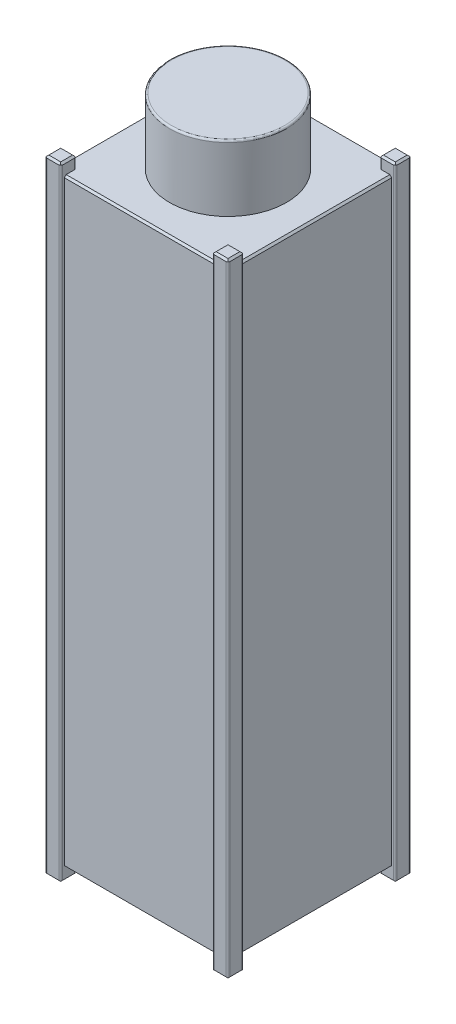
from build123d import *

# Parameters (mm, degrees)
SKETCH1_W                = 100
SKETCH1_H                = 100
BOSS_EXTRUDE1_DEPTH      = 327.8
SKETCH2_W                = 8.5
SKETCH2_H                = 8.5
BOSS_EXTRUDE2_DEPTH      = 6.5
CHAMFER1_SIZE            = 1
SKETCH3_R                = 32
BOSS_EXTRUDE3_DEPTH      = 36
CHAMFER1_OF_MIRROR1_SIZE = 1
FILLET1_R                = 1
SKETCH6_W                = 83
SKETCH6_H                = 327.8
CUT_EXTRUDE1_DEPTH       = 2
CIRPATTERN1_COUNT        = 4
FILLET2_R                = 1
FILLET3_R                = 1
CHAMFER2_SIZE            = 1


with BuildPart() as part:
    # Sketch1 → Boss-Extrude1 (new body)
    with BuildSketch(Plane(origin=(0, 0, 0), x_dir=(1, 0, 0), z_dir=(0, 1, 0))):
        Rectangle(SKETCH1_W, SKETCH1_H)
    extrude(amount=BOSS_EXTRUDE1_DEPTH)

    # Sketch2 → Boss-Extrude2 (add)
    with BuildSketch(Plane(origin=(0, 327.8, 0), x_dir=(1, 0, 0), z_dir=(0, 1, 0))):
        with Locations((45.75, 45.75)):
            Rectangle(SKETCH2_W, SKETCH2_H)
        with Locations((-45.75, 45.75)):
            Rectangle(SKETCH2_W, SKETCH2_H)
        with Locations((45.75, -45.75)):
            Rectangle(SKETCH2_W, SKETCH2_H)
        with Locations((-45.75, -45.75)):
            Rectangle(SKETCH2_W, SKETCH2_H)
    boss_extrude2 = extrude(amount=BOSS_EXTRUDE2_DEPTH)

    # Chamfer1
    chamfer1_edges = [part.edges().sort_by_distance(p)[0] for p in [
        (45.75, 334.3, -41.5),
        (41.5, 334.3, -45.75),
        (45.75, 334.3, -50),
        (50, 334.3, -45.75),
        (41.5, 334.3, 45.75),
        (45.75, 334.3, 41.5),
        (50, 334.3, 45.75),
        (45.75, 334.3, 50),
        (-50, 334.3, 45.75),
        (-45.75, 334.3, 41.5),
        (-41.5, 334.3, 45.75),
        (-45.75, 334.3, 50),
        (-45.75, 334.3, -50),
        (-41.5, 334.3, -45.75),
        (-45.75, 334.3, -41.5),
        (-50, 334.3, -45.75),
    ]]
    chamfer(chamfer1_edges, length=CHAMFER1_SIZE)

    # Sketch3 → Boss-Extrude3 (add)
    with BuildSketch(Plane(origin=(0, 327.8, 0), x_dir=(1, 0, 0), z_dir=(0, 1, 0))):
        with Locations(Location((0, 0, 0), (0, 0, 90))):
            Circle(SKETCH3_R)
    extrude(amount=BOSS_EXTRUDE3_DEPTH)

    # Mirror1: Boss-Extrude2 across plane
    add(boss_extrude2.mirror(Plane.ZX.offset(163.9)))

    # Chamfer1 of Mirror1
    chamfer1_of_mirror1_edges = [part.edges().sort_by_distance(p)[0] for p in [
        (45.75, -6.5, -41.5),
        (41.5, -6.5, -45.75),
        (45.75, -6.5, -50),
        (50, -6.5, -45.75),
        (41.5, -6.5, 45.75),
        (45.75, -6.5, 41.5),
        (50, -6.5, 45.75),
        (45.75, -6.5, 50),
        (-50, -6.5, 45.75),
        (-45.75, -6.5, 41.5),
        (-41.5, -6.5, 45.75),
        (-45.75, -6.5, 50),
        (-45.75, -6.5, -50),
        (-41.5, -6.5, -45.75),
        (-45.75, -6.5, -41.5),
        (-50, -6.5, -45.75),
    ]]
    chamfer(chamfer1_of_mirror1_edges, length=CHAMFER1_OF_MIRROR1_SIZE)

    # Fillet1
    fillet1_edges = [part.edges().sort_by_distance(p)[0] for p in [
        (-50, 163.9, -50),
        (50, 163.9, -50),
        (50, 163.9, 50),
        (-50, 163.9, 50),
    ]]
    fillet(fillet1_edges, radius=FILLET1_R)

    # Sketch6 → Cut-Extrude1 (cut)
    with BuildSketch(Plane(origin=(0, 0, -50), x_dir=(-1, 0, 0), z_dir=(0, 0, -1))):
        with Locations((0, 163.9)):
            Rectangle(SKETCH6_W, SKETCH6_H)
    cut_extrude1 = extrude(amount=-CUT_EXTRUDE1_DEPTH, mode=Mode.SUBTRACT)

    # CirPattern1: Cut-Extrude1 ×4 about axis
    cirpattern1_axis = Axis((0, 0, 0), (0, 1, 0))
    for i in range(1, CIRPATTERN1_COUNT):
        add(cut_extrude1.rotate(cirpattern1_axis, i * 360 / CIRPATTERN1_COUNT), mode=Mode.SUBTRACT)

    # Fillet2
    fillet2_edges = [part.edges().sort_by_distance(p)[0] for p in [
        (0, 363.8, 32),
    ]]
    fillet(fillet2_edges, radius=FILLET2_R)

    # Fillet3
    fillet3_edges = [part.edges().sort_by_distance(p)[0] for p in [
        (41.5, -2.75, -41.5),
        (41.5, -2.75, 41.5),
        (-41.5, -2.75, 41.5),
        (-41.5, -2.75, -41.5),
        (50, 163.9, -41.5),
        (41.5, 330.55, -41.5),
        (41.5, 163.9, -50),
        (-41.5, 163.9, -50),
        (50, 163.9, 41.5),
        (41.5, 163.9, 50),
        (41.5, 330.55, 41.5),
        (-41.5, 163.9, 50),
        (-50, 163.9, 41.5),
        (-50, 163.9, -41.5),
        (-41.5, 330.55, 41.5),
        (-41.5, 330.55, -41.5),
    ]]
    fillet(fillet3_edges, radius=FILLET3_R)

    # Chamfer2
    chamfer2_edges = [part.edges().sort_by_distance(p)[0] for p in [
        (48, 0, 0),
        (0, 0, 48),
        (0, 0, -48),
        (-48, 0, 0),
        (48, 327.8, 0),
        (0, 327.8, -48),
        (0, 327.8, 48),
        (-48, 327.8, 0),
    ]]
    chamfer(chamfer2_edges, length=CHAMFER2_SIZE)


solid = part.part
